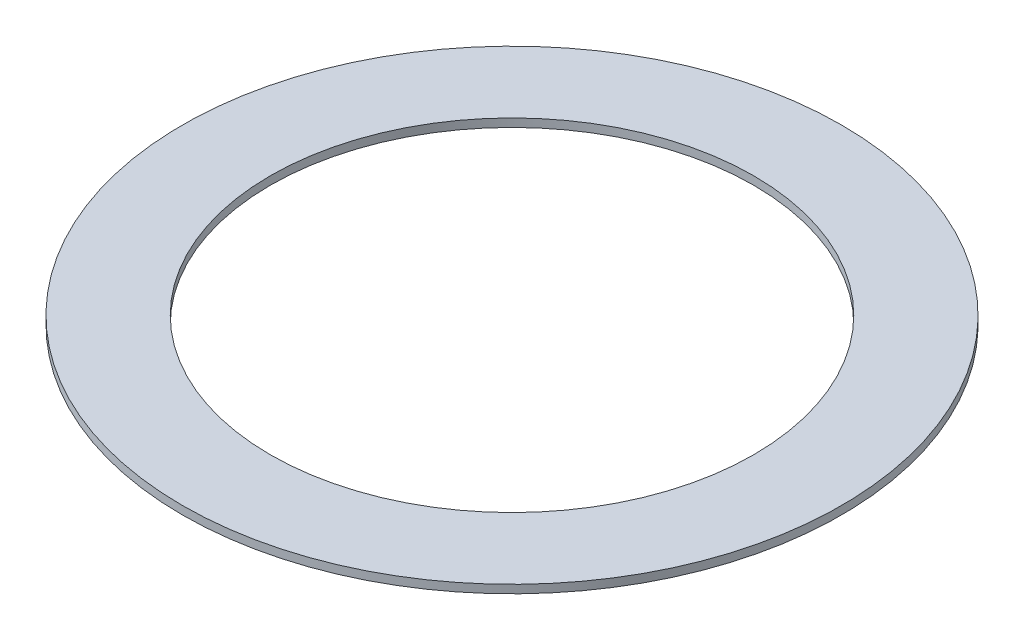
from build123d import *

# Parameters (mm, degrees)
SKETCH1_R           = 8.001
BOSS_EXTRUDE1_DEPTH = 0.2
SKETCH2_R           = 5.8674
CUT_EXTRUDE1_DEPTH  = 12.316890121


with BuildPart() as part:
    # Sketch1 → Boss-Extrude1 (new body)
    with BuildSketch(Plane(origin=(0, 0, 0), x_dir=(1, 0, 0), z_dir=(0, 1, 0))):
        with Locations(Location((0, 0, 0), (0, 0, 270))):
            Circle(SKETCH1_R)
    extrude(amount=BOSS_EXTRUDE1_DEPTH)

    # Sketch2 → Cut-Extrude1 (cut, through all)
    with BuildSketch(Plane(origin=(0, 0, 0), x_dir=(-1, 0, 0), z_dir=(0, -1, 0))):
        with Locations(Location((0, 0, 0), (0, 0, 90))):
            Circle(SKETCH2_R)
    extrude(amount=-CUT_EXTRUDE1_DEPTH, mode=Mode.SUBTRACT)


solid = part.part
